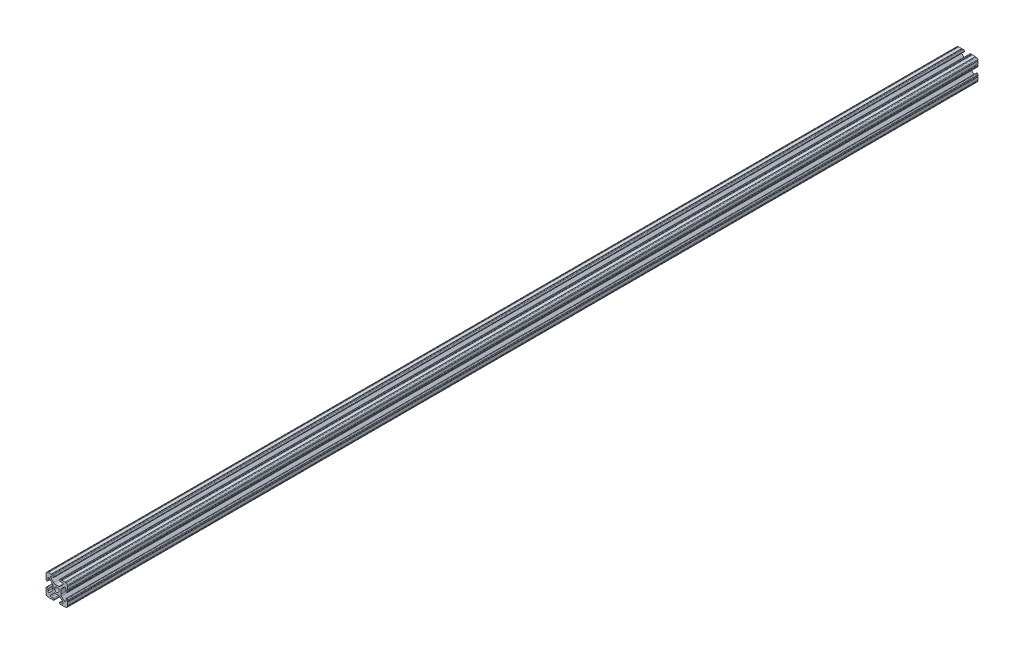
from build123d import *

# Parameters (mm, degrees)
SKETCH1_R           = 2.6035
BOSS_EXTRUDE1_DEPTH = 1066.8


with BuildPart() as part:
    # Sketch1 → Boss-Extrude1 (new body)
    with BuildSketch(Plane.XY):
        with BuildLine():
            Line((-3.737334562, -5.299899128), (-7.103895736, -8.666460301))
            ThreePointArc((-7.103895736, -8.666460301), (-7.335478831, -9.830707141), (-6.348478019, -10.4902))
            Line((-6.348478019, -10.4902), (-4.190365, -10.4902))
            ThreePointArc((-4.190365, -10.4902), (-3.52627506, -10.76527506), (-3.2512, -11.429365))
            Line((-3.2512, -11.429365), (-3.2512, -11.760835))
            ThreePointArc((-3.2512, -11.760835), (-3.52627506, -12.42492494), (-4.190365, -12.7))
            Line((-4.190365, -12.7), (-5.243578019, -12.7))
            ThreePointArc((-5.243578019, -12.7), (-5.796028019, -12.14755), (-6.348478019, -12.7))
            Line((-6.348478019, -12.7), (-9.803703153, -12.7))
            ThreePointArc((-9.803703153, -12.7), (-10.295790179, -12.150857656), (-10.895412136, -12.579996867))
            ThreePointArc((-10.895412136, -12.579996867), (-11.943543586, -11.943543585), (-12.579996867, -10.895412135))
            ThreePointArc((-12.579996867, -10.895412135), (-12.150857661, -10.295790179), (-12.7, -9.803703154))
            Line((-12.7, -9.803703154), (-12.7, -6.348478019))
            ThreePointArc((-12.7, -6.348478019), (-12.14755, -5.796028019), (-12.7, -5.243578019))
            Line((-12.7, -5.243578019), (-12.7, -4.190365))
            ThreePointArc((-12.7, -4.190365), (-12.42492494, -3.52627506), (-11.760835, -3.2512))
            Line((-11.760835, -3.2512), (-11.429365, -3.2512))
            ThreePointArc((-11.429365, -3.2512), (-10.76527506, -3.52627506), (-10.4902, -4.190365))
            Line((-10.4902, -4.190365), (-10.4902, -6.348478019))
            ThreePointArc((-10.4902, -6.348478019), (-9.830707141, -7.335478831), (-8.666460302, -7.103895737))
            Line((-8.666460302, -7.103895737), (-5.299899128, -3.737334563))
            ThreePointArc((-5.299899128, -3.737334563), (-4.817571085, -3.015479635), (-4.6482, -2.163993691))
            Line((-4.6482, -2.163993691), (-4.6482, 2.16399369))
            ThreePointArc((-4.6482, 2.16399369), (-4.817571084, 3.015479634), (-5.299899127, 3.737334562))
            Line((-5.299899127, 3.737334562), (-8.666460301, 7.103895736))
            ThreePointArc((-8.666460301, 7.103895736), (-9.83070714, 7.335478831), (-10.490199999, 6.348478019))
            Line((-10.490199999, 6.348478019), (-10.490199999, 4.190365))
            ThreePointArc((-10.490199999, 4.190365), (-10.765275058, 3.52627506), (-11.429364999, 3.2512))
            Line((-11.429364999, 3.2512), (-11.760834999, 3.2512))
            ThreePointArc((-11.760834999, 3.2512), (-12.424924939, 3.52627506), (-12.699999999, 4.190365))
            Line((-12.699999999, 4.190365), (-12.699999999, 5.243578019))
            ThreePointArc((-12.699999999, 5.243578019), (-12.147549999, 5.796028019), (-12.699999999, 6.348478019))
            Line((-12.699999999, 6.348478019), (-12.699999999, 9.803703154))
            ThreePointArc((-12.699999999, 9.803703154), (-12.15085766, 10.295790179), (-12.579996866, 10.895412135))
            ThreePointArc((-12.579996866, 10.895412135), (-11.943543584, 11.943543586), (-10.895412134, 12.579996867))
            ThreePointArc((-10.895412134, 12.579996867), (-10.295790177, 12.150857661), (-9.803703152, 12.7))
            Line((-9.803703152, 12.7), (-6.348478018, 12.7))
            ThreePointArc((-6.348478018, 12.7), (-5.796028018, 12.14755), (-5.243578018, 12.7))
            Line((-5.243578018, 12.7), (-4.190364999, 12.7))
            ThreePointArc((-4.190364999, 12.7), (-3.526275058, 12.42492494), (-3.251199999, 11.760835))
            Line((-3.251199999, 11.760835), (-3.251199999, 11.429365))
            ThreePointArc((-3.251199999, 11.429365), (-3.526275058, 10.76527506), (-4.190364999, 10.4902))
            Line((-4.190364999, 10.4902), (-6.348478018, 10.4902))
            ThreePointArc((-6.348478018, 10.4902), (-7.33547883, 9.830707142), (-7.103895735, 8.666460303))
            Line((-7.103895735, 8.666460303), (-3.737334561, 5.299899129))
            ThreePointArc((-3.737334561, 5.299899129), (-3.015479634, 4.817571086), (-2.16399369, 4.6482))
            Line((-2.16399369, 4.6482), (2.163993692, 4.6482))
            ThreePointArc((2.163993692, 4.6482), (3.015479636, 4.817571085), (3.737334564, 5.299899128))
            Line((3.737334564, 5.299899128), (7.103895738, 8.666460302))
            ThreePointArc((7.103895738, 8.666460302), (7.335478833, 9.830707141), (6.348478021, 10.4902))
            Line((6.348478021, 10.4902), (4.190365002, 10.4902))
            ThreePointArc((4.190365002, 10.4902), (3.526275062, 10.76527506), (3.251200002, 11.429365))
            Line((3.251200002, 11.429365), (3.251200002, 11.760835))
            ThreePointArc((3.251200002, 11.760835), (3.526275062, 12.42492494), (4.190365002, 12.7))
            Line((4.190365002, 12.7), (5.243578021, 12.7))
            ThreePointArc((5.243578021, 12.7), (5.796028021, 12.14755), (6.348478021, 12.7))
            Line((6.348478021, 12.7), (9.803703155, 12.7))
            ThreePointArc((9.803703155, 12.7), (10.295790181, 12.150857656), (10.895412138, 12.579996867))
            ThreePointArc((10.895412138, 12.579996867), (11.943543588, 11.943543585), (12.579996869, 10.895412136))
            ThreePointArc((12.579996869, 10.895412136), (12.150857663, 10.295790179), (12.700000001, 9.803703154))
            Line((12.700000001, 9.803703154), (12.700000001, 6.34847802))
            ThreePointArc((12.700000001, 6.34847802), (12.147550001, 5.79602802), (12.700000001, 5.24357802))
            Line((12.700000001, 5.24357802), (12.700000001, 4.190365001))
            ThreePointArc((12.700000001, 4.190365001), (12.424924941, 3.526275061), (11.760835001, 3.251200001))
            Line((11.760835001, 3.251200001), (11.429365001, 3.251200001))
            ThreePointArc((11.429365001, 3.251200001), (10.765275061, 3.526275061), (10.490200001, 4.190365001))
            Line((10.490200001, 4.190365001), (10.490200001, 6.34847802))
            ThreePointArc((10.490200001, 6.34847802), (9.830707143, 7.335478832), (8.666460303, 7.103895738))
            Line((8.666460303, 7.103895738), (5.299899129, 3.737334564))
            ThreePointArc((5.299899129, 3.737334564), (4.817571086, 3.015479636), (4.648200001, 2.163993692))
            Line((4.648200001, 2.163993692), (4.648200001, -2.163993689))
            ThreePointArc((4.648200001, -2.163993689), (4.817571086, -3.015479633), (5.299899128, -3.737334561))
            Line((5.299899128, -3.737334561), (8.666460302, -7.103895735))
            ThreePointArc((8.666460302, -7.103895735), (9.830707141, -7.33547883), (10.4902, -6.348478018))
            Line((10.4902, -6.348478018), (10.4902, -4.190364999))
            ThreePointArc((10.4902, -4.190364999), (10.76527506, -3.526275059), (11.429365, -3.251199999))
            Line((11.429365, -3.251199999), (11.760835, -3.251199999))
            ThreePointArc((11.760835, -3.251199999), (12.42492494, -3.526275059), (12.7, -4.190364999))
            Line((12.7, -4.190364999), (12.7, -5.243578018))
            ThreePointArc((12.7, -5.243578018), (12.14755, -5.796028018), (12.7, -6.348478018))
            Line((12.7, -6.348478018), (12.7, -9.803703153))
            ThreePointArc((12.7, -9.803703153), (12.150857661, -10.295790178), (12.579996867, -10.895412134))
            ThreePointArc((12.579996867, -10.895412134), (11.943543586, -11.943543584), (10.895412136, -12.579996866))
            ThreePointArc((10.895412136, -12.579996866), (10.295790179, -12.150857655), (9.803703154, -12.699999999))
            Line((9.803703154, -12.699999999), (6.348478019, -12.699999999))
            ThreePointArc((6.348478019, -12.699999999), (5.796028019, -12.147549999), (5.243578019, -12.699999999))
            Line((5.243578019, -12.699999999), (4.190365, -12.699999999))
            ThreePointArc((4.190365, -12.699999999), (3.52627506, -12.424924939), (3.2512, -11.760834999))
            Line((3.2512, -11.760834999), (3.2512, -11.429364999))
            ThreePointArc((3.2512, -11.429364999), (3.52627506, -10.765275059), (4.190365, -10.490199999))
            Line((4.190365, -10.490199999), (6.348478019, -10.490199999))
            ThreePointArc((6.348478019, -10.490199999), (7.335478831, -9.830707141), (7.103895737, -8.666460301))
            Line((7.103895737, -8.666460301), (3.737334563, -5.299899128))
            ThreePointArc((3.737334563, -5.299899128), (3.015479635, -4.817571085), (2.163993691, -4.648199999))
            Line((2.163993691, -4.648199999), (-2.163993691, -4.648199999))
            ThreePointArc((-2.163993691, -4.648199999), (-3.015479635, -4.817571085), (-3.737334562, -5.299899128))
        make_face()
        Circle(SKETCH1_R, mode=Mode.SUBTRACT)
    extrude(amount=BOSS_EXTRUDE1_DEPTH)


solid = part.part
